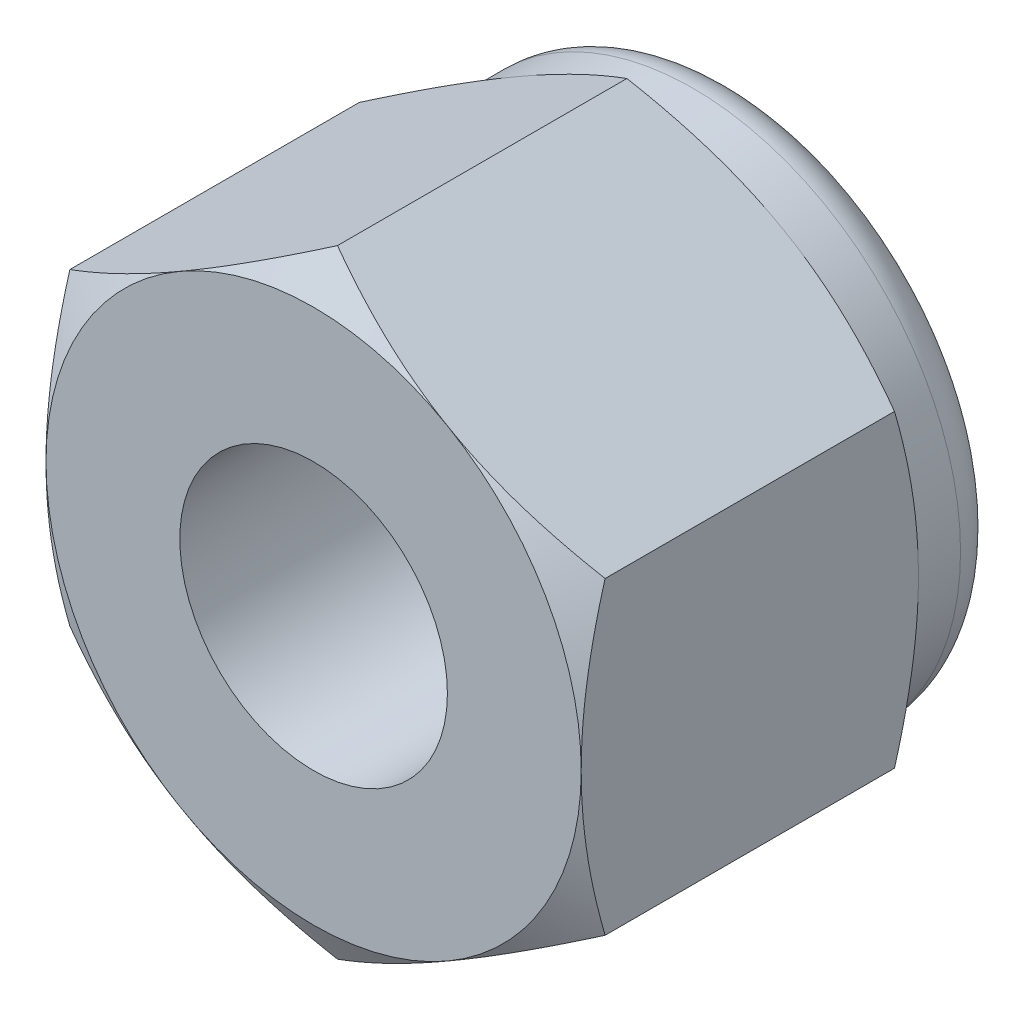
from build123d import *

# Parameters (mm, degrees)
BASE_EXTRUSION_DEPTH    = 5.04
ESQUISSE3_R             = 2.5
ENL_V_MAT_EXTRU_1_DEPTH = 8.920538702
ESQUISSE5_R             = 2.5
ESQUISSE5_R_2           = 2
BOSS_EXTRU_1_DEPTH      = 5.04


with BuildPart() as part:
    # Esquisse1 → Base-Extrusion (new body)
    with BuildSketch(Plane.XY):
        Polygon((4, -2.309401077), (4, 2.309401077), (0, 4.618802154), (-4, 2.309401077), (-4, -2.309401077), (0, -4.618802154), align=None)
    extrude(amount=-BASE_EXTRUSION_DEPTH)

    # Esquisse2 → Enlèvement de matière-Révolution1 (revolve, cut)
    with BuildSketch(Plane(origin=(0, 0, 0), x_dir=(1, 0, 0), z_dir=(0, 1, 0))):
        Polygon((-4, 0), (-9.364768035, 0), (-9.364768035, 5.04), (-4, 5.04), (-8.364768035, 2.52), align=None)
    revolve(axis=Axis((0, 0, -5.04), (0, 0, 1)), mode=Mode.SUBTRACT)

    # Esquisse3 → Enlèv. mat.-Extru.1 (cut, through all)
    with BuildSketch(Plane.XY):
        Circle(ESQUISSE3_R)
    extrude(amount=-ENL_V_MAT_EXTRU_1_DEPTH, mode=Mode.SUBTRACT)

    # Esquisse4 → Boss.-Révol.1 (revolve)
    with BuildSketch(Plane(origin=(0, 0, 0), x_dir=(0, 0, -1), z_dir=(1, 0, 0)), mode=Mode.PRIVATE) as boss_r_vol_1_sk:
        with BuildLine():
            Line((5.04, 4), (5.67, 4))
            ThreePointArc((5.67, 4), (6.115477272, 3.815477272), (6.3, 3.37))
            Line((6.3, 3.37), (6.3, 3.154700538))
            Line((6.3, 3.154700538), (5.775, 3.154700538))
            Line((5.775, 3.154700538), (5.775, 2.309401077))
            Line((5.775, 2.309401077), (5.04, 2.309401077))
            Line((5.04, 2.309401077), (5.04, 4))
        make_face()
    revolve(boss_r_vol_1_sk.sketch.rotate(Axis((0, 0, 0), (0, 0, -1)), 90), axis=Axis((0, 0, 0), (0, 0, -1)))

    # Esquisse5 → Boss.-Extru.1 (add)
    with BuildSketch(Plane.XY):
        Circle(ESQUISSE5_R)
        Circle(ESQUISSE5_R_2, mode=Mode.SUBTRACT)
    extrude(amount=-BOSS_EXTRU_1_DEPTH)


solid = part.part
